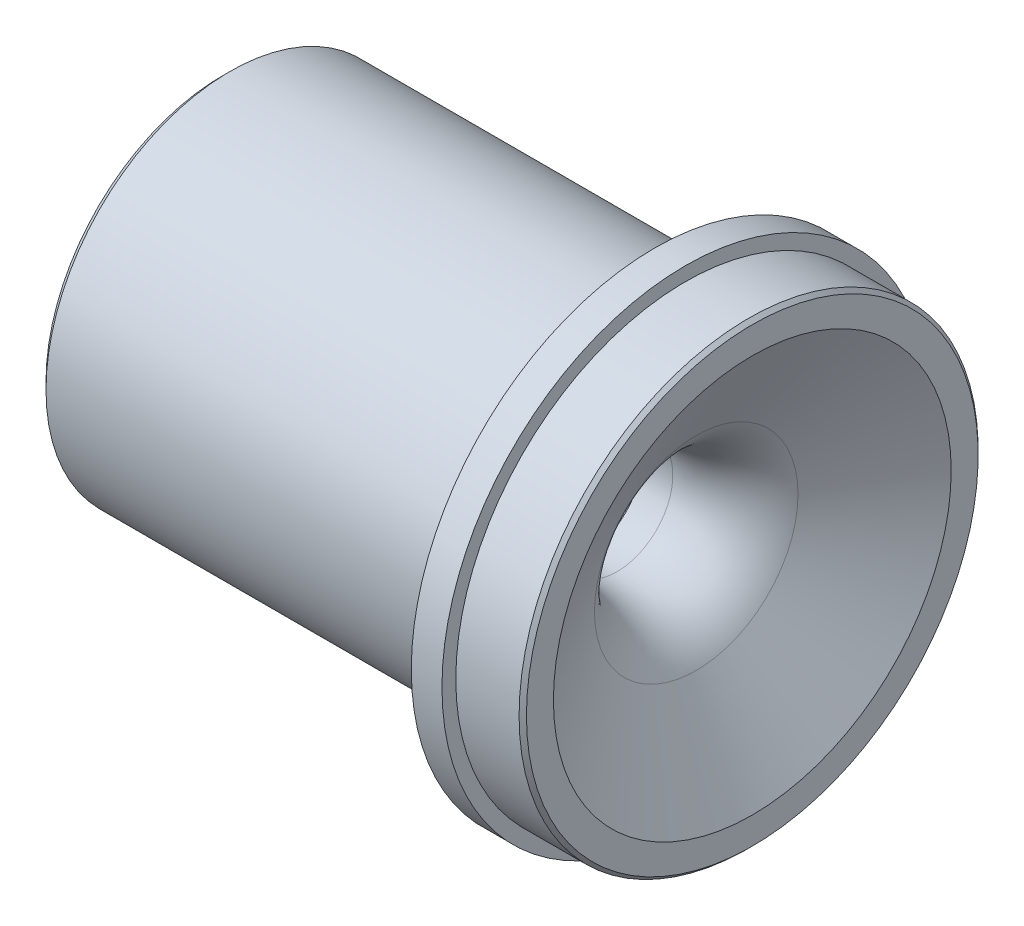
from build123d import *


with BuildPart() as part:
    # Sketch1 → Revolve1 (revolve)
    with BuildSketch(Plane.XY, mode=Mode.PRIVATE) as revolve1_sk:
        with BuildLine():
            Line((-27.432, 15.875), (10.248650979, 5.7785))
            Line((10.248650979, 5.7785), (13.423650979, 5.7785))
            ThreePointArc((13.423650979, 5.7785), (18.15901576, 7.066472027), (21.624710712, 10.540879898))
            Line((21.624710712, 10.540879898), (27.432, 20.5994))
            Line((27.432, 20.5994), (27.432, 23.3934))
            Line((27.432, 23.3934), (27.051, 23.7744))
            Line((27.051, 23.7744), (20.4978, 23.7744))
            Line((20.4978, 23.7744), (20.4978, 25.2095))
            Line((20.4978, 25.2095), (17.3228, 25.2095))
            Line((17.3228, 25.2095), (17.3228, 22.2123))
            Line((17.3228, 22.2123), (15.5448, 22.2123))
            Line((15.5448, 22.2123), (15.5448, 20.447))
            Line((15.5448, 20.447), (14.1478, 19.05))
            Line((14.1478, 19.05), (-26.67, 19.05))
            Line((-26.67, 19.05), (-27.432, 18.288))
            Line((-27.432, 18.288), (-27.432, 15.875))
        make_face()
    revolve(revolve1_sk.sketch.rotate(Axis((-39.917319276, 0, 0), (1, 0, 0)), 90), axis=Axis((-39.917319276, 0, 0), (1, 0, 0)))


solid = part.part
